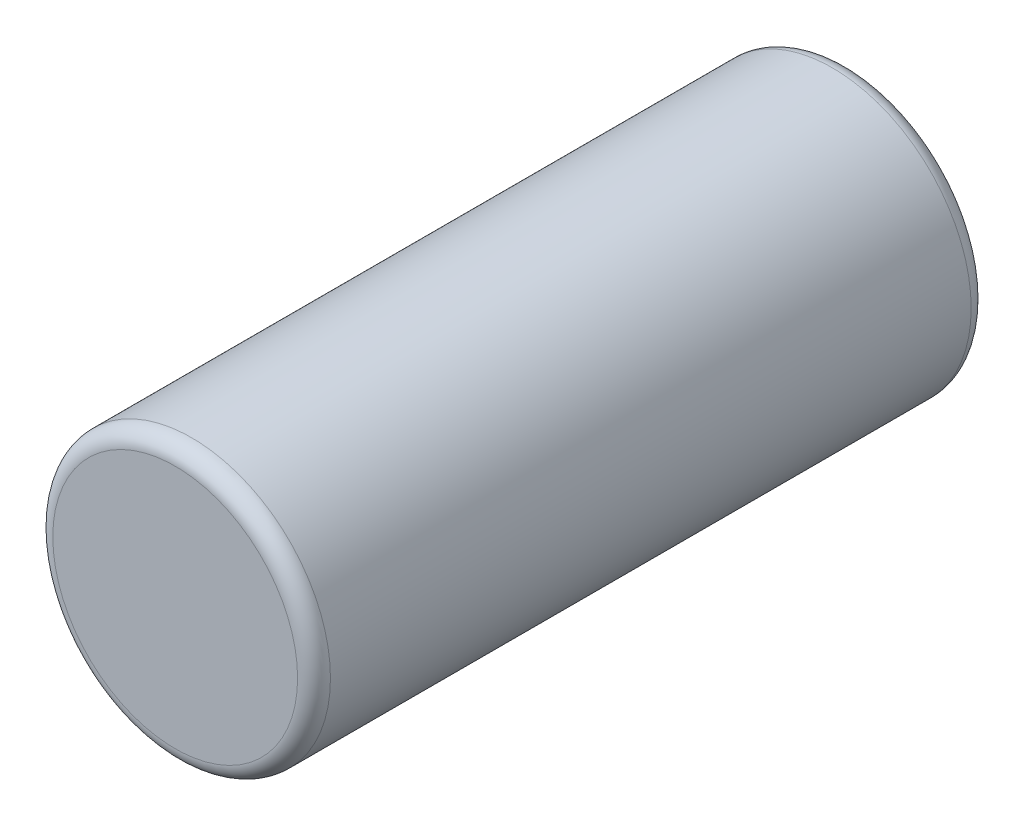
from build123d import *

# Parameters (mm, degrees)
IZIM2_R                     = 16.9
Y_KSEKLIK_EKSTR_ZYON1_DEPTH = 41
RADYUS1_R                   = 2


with BuildPart() as part:
    # Çizim2 → Yükseklik-Ekstrüzyon1 (new, symmetric)
    with BuildSketch(Plane.XY):
        Circle(IZIM2_R)
    extrude(amount=Y_KSEKLIK_EKSTR_ZYON1_DEPTH, both=True)

    # Radyus1
    radyus1_edges = [part.edges().sort_by_distance(p)[0] for p in [
        (-16.9, 0, -41),
        (-16.9, 0, 41),
    ]]
    fillet(radyus1_edges, radius=RADYUS1_R)


solid = part.part
